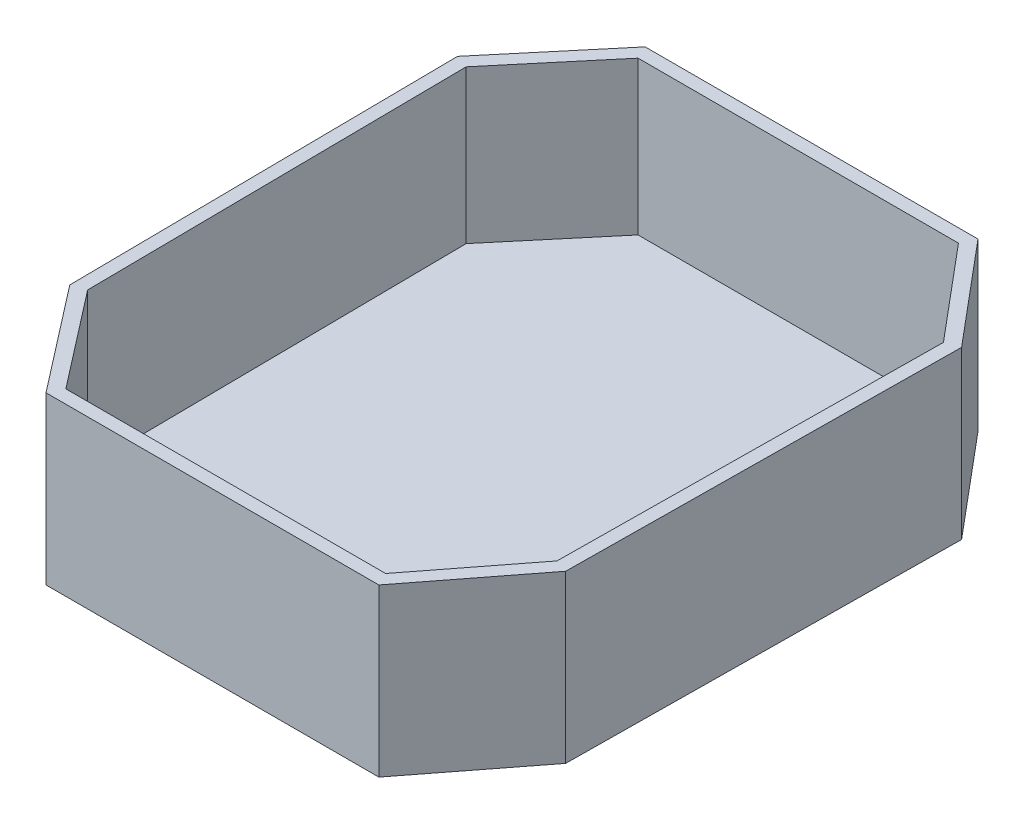
from build123d import *

# Parameters (mm, degrees)
AUFSATZ_LINEAR_AUSTRAGEN1_DEPTH = 25
WANDUNG2_T                      = -2


with BuildPart() as part:
    # Skizze1 → Aufsatz-Linear austragen1 (new body)
    with BuildSketch(Plane(origin=(0, 0, 0), x_dir=(1, 0, 0), z_dir=(0, 1, 0))):
        Polygon((0, -50.171355376), (-25, -50.171355376), (-37.244282987, -34.357515421), (-37.855752194, 24.507755761), (-25, 39.828644624), (0, 39.828644624), align=None)
    aufsatz_linear_austragen1 = extrude(amount=AUFSATZ_LINEAR_AUSTRAGEN1_DEPTH)

    # Spiegeln1: Aufsatz-Linear austragen1 across plane
    add(aufsatz_linear_austragen1.mirror(Plane(origin=(0, 0, 0), x_dir=(0, 0, 1), z_dir=(1, 0, 0))))

    # Wandung2
    wandung2_openings = [part.faces().sort_by_distance(p)[0] for p in [
        (0, 25, 5.030518753),
    ]]
    offset(amount=WANDUNG2_T, openings=wandung2_openings, kind=Kind.INTERSECTION)


solid = part.part
